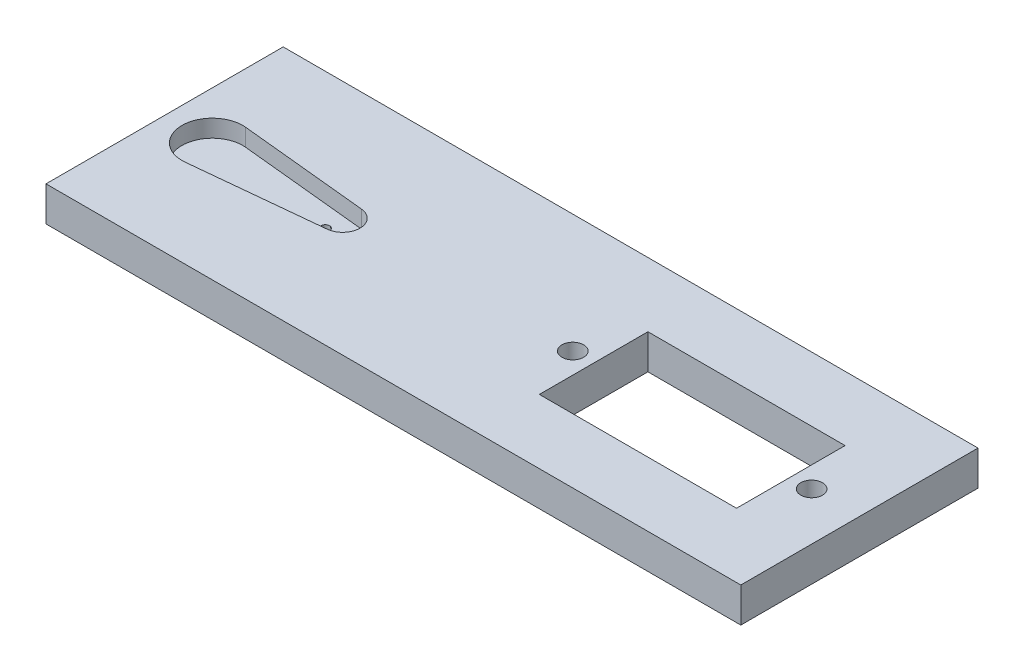
from build123d import *

# Parameters (mm, degrees)
SKETCH_1_W      = 80
SKETCH_1_H      = 27.309222572
SKETCH_1_R      = 1.25
SKETCH_1_W_2    = 22.7
SKETCH_1_H_2    = 12.5
EXTRUDE_2_DEPTH = 4
SKETCH_1_4_R    = 0.5
EXTRUDE_3_DEPTH = 2


with BuildPart() as part:
    # 草图1 → 凸台-拉伸2 (new body)
    with BuildSketch(Plane(origin=(0, 0, 0), x_dir=(1, 0, 0), z_dir=(0, 1, 0))):
        Rectangle(SKETCH_1_W, SKETCH_1_H)
        with BuildLine():
            ThreePointArc((-34.15, -3.48245603), (-38, 0), (-34.15, 3.48245603))
            Line((-34.15, 3.48245603), (-19.3, 1.989974874))
            ThreePointArc((-19.3, 1.989974874), (-18.016760303, 1.341640786), (-17.5, 0))
            ThreePointArc((-17.5, 0), (-18.016760303, -1.341640786), (-19.3, -1.989974874))
            Line((-19.3, -1.989974874), (-34.15, -3.48245603))
        make_face(mode=Mode.SUBTRACT)
        with Locations((7, 0)):
            Circle(SKETCH_1_R, mode=Mode.SUBTRACT)
        with Locations((20.75, 0)):
            Rectangle(SKETCH_1_W_2, SKETCH_1_H_2, mode=Mode.SUBTRACT)
        with Locations((34.5, 0)):
            Circle(SKETCH_1_R, mode=Mode.SUBTRACT)
    extrude(amount=EXTRUDE_2_DEPTH)

    # 草图1<4> → 凸台-拉伸3 (add)
    with BuildSketch(Plane(origin=(0, 0, 0), x_dir=(1, 0, 0), z_dir=(0, 1, 0))):
        with BuildLine():
            Line((-19.3, 1.989974874), (-34.15, 3.48245603))
            ThreePointArc((-34.15, 3.48245603), (-38, 0), (-34.15, -3.48245603))
            Line((-34.15, -3.48245603), (-19.3, -1.989974874))
            ThreePointArc((-19.3, -1.989974874), (-17.5, 0), (-19.3, 1.989974874))
        make_face()
        with Locations((-21.5, 0)):
            Circle(SKETCH_1_4_R, mode=Mode.SUBTRACT)
    extrude(amount=EXTRUDE_3_DEPTH)


solid = part.part
